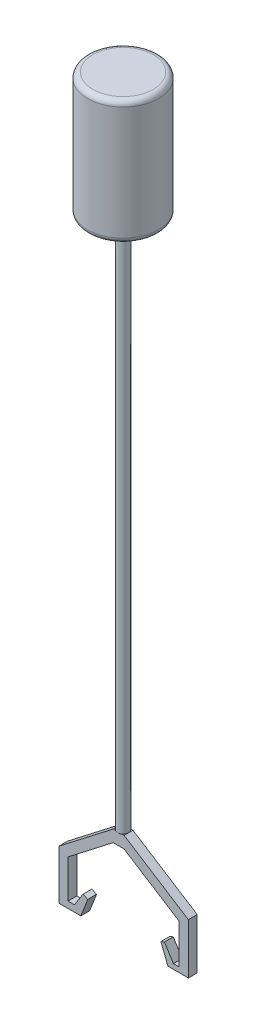
from build123d import *

# Parameters (mm, degrees)
CROQUIS1_R              = 100
SALIENTE_EXTRUIR1_DEPTH = 350
REDONDEO1_R             = 15
CROQUIS2_R              = 15.374662703
SALIENTE_EXTRUIR2_DEPTH = 1500
SALIENTE_EXTRUIR3_DEPTH = 12.5


with BuildPart() as part:
    # Croquis1 → Saliente-Extruir1 (new body)
    with BuildSketch(Plane(origin=(0, 0, 0), x_dir=(1, 0, 0), z_dir=(0, 1, 0))):
        with Locations(Location((0, 0, 0), (0, 0, 270))):
            Circle(CROQUIS1_R)
    extrude(amount=SALIENTE_EXTRUIR1_DEPTH)

    # Redondeo1
    redondeo1_edges = [part.edges().sort_by_distance(p)[0] for p in [
        (0, 0, -100),
        (0, 350, -100),
    ]]
    fillet(redondeo1_edges, radius=REDONDEO1_R)

    # Croquis2 → Saliente-Extruir2 (add)
    with BuildSketch(Plane.XZ):
        with Locations(Location((0, 0, 0), (0, 0, 90))):
            Circle(CROQUIS2_R)
    extrude(amount=SALIENTE_EXTRUIR2_DEPTH)

    # Croquis3 → Saliente-Extruir3 (add, symmetric)
    with BuildSketch(Plane.XY):
        Polygon((15.374662703, -1500), (196.643299481, -1615.247729776), (196.643299481, -1757.608907892), (169.890863325, -1757.608907892), (138.99299414, -1757.608907892), (119.105323431, -1707.327980329), (129.049158786, -1703.39488417), (154.441928733, -1743.657312209), (169.890863325, -1743.657312209), (169.890863325, -1631.4902803), (15.374662703, -1533.251325939), (-15.374662703, -1533.251325939), (-142.53937321, -1631.4902803), (-142.53937321, -1739.389775564), (-124.574455385, -1739.389775564), (-120.173982412, -1732.468444111), (-100.774753954, -1701.956158064), (-87.000489723, -1707.327980329), (-106.60953756, -1757.608907892), (-142.53937321, -1757.608907892), (-168.799765014, -1757.608907892), (-168.799765014, -1618.525977557), (-158.626316744, -1610.66665152), (-15.374662703, -1500), align=None)
    extrude(amount=SALIENTE_EXTRUIR3_DEPTH, both=True)


solid = part.part
